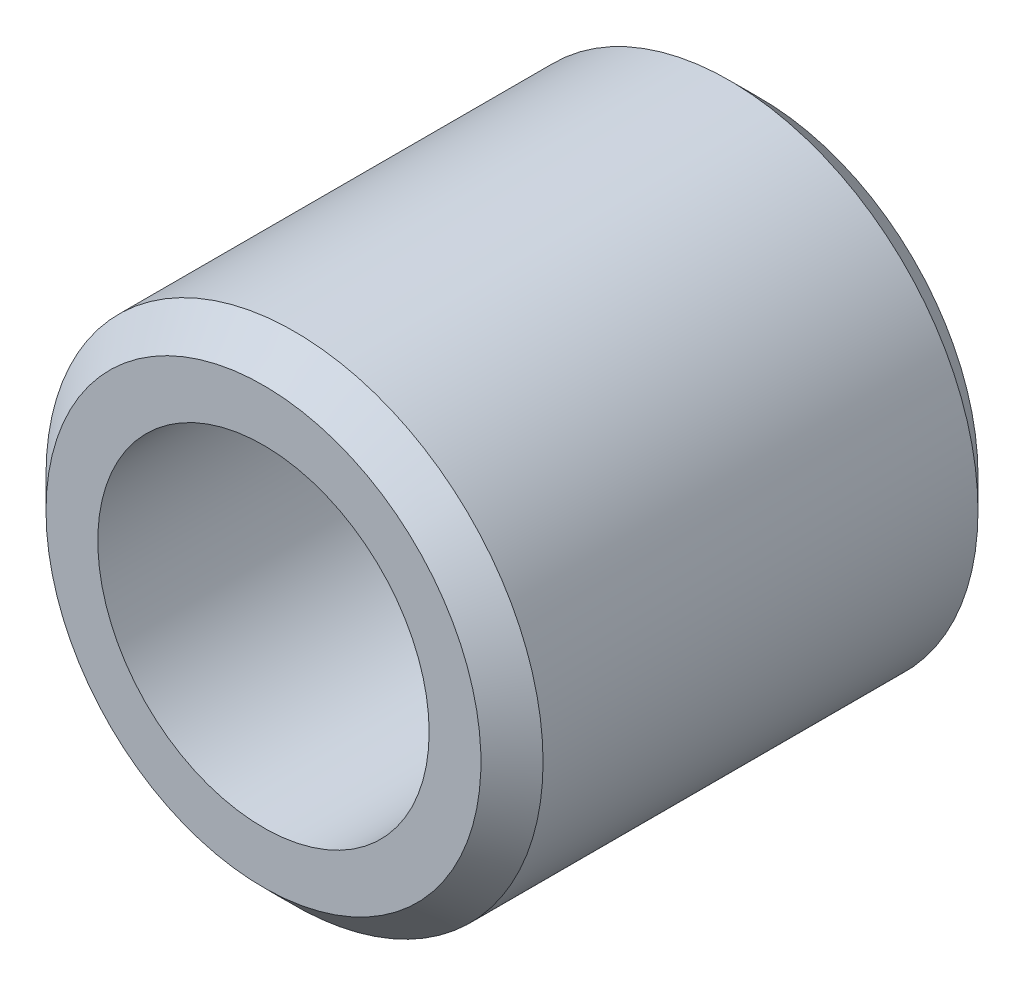
from build123d import *

# Parameters (mm, degrees)
SKETCH3_W     = 9.525
SKETCH3_H     = 1.5875
CHAMFER1_SIZE = 0.5953125


with BuildPart() as part:
    # Sketch3 → Revolve1 (revolve)
    with BuildSketch(Plane(origin=(0, 0, 0), x_dir=(0, 0, -1), z_dir=(1, 0, 0)), mode=Mode.PRIVATE) as revolve1_sk:
        with Locations((0, 3.96875)):
            Rectangle(SKETCH3_W, SKETCH3_H)
    revolve(revolve1_sk.sketch.rotate(Axis((0, 0, 4.7625), (0, 0, -1)), 90), axis=Axis((0, 0, 4.7625), (0, 0, -1)))

    # Chamfer1
    chamfer1_edges = [part.edges().sort_by_distance(p)[0] for p in [
        (-4.7625, 0, 4.7625),
        (-4.7625, 0, -4.7625),
    ]]
    chamfer(chamfer1_edges, length=CHAMFER1_SIZE)


solid = part.part
